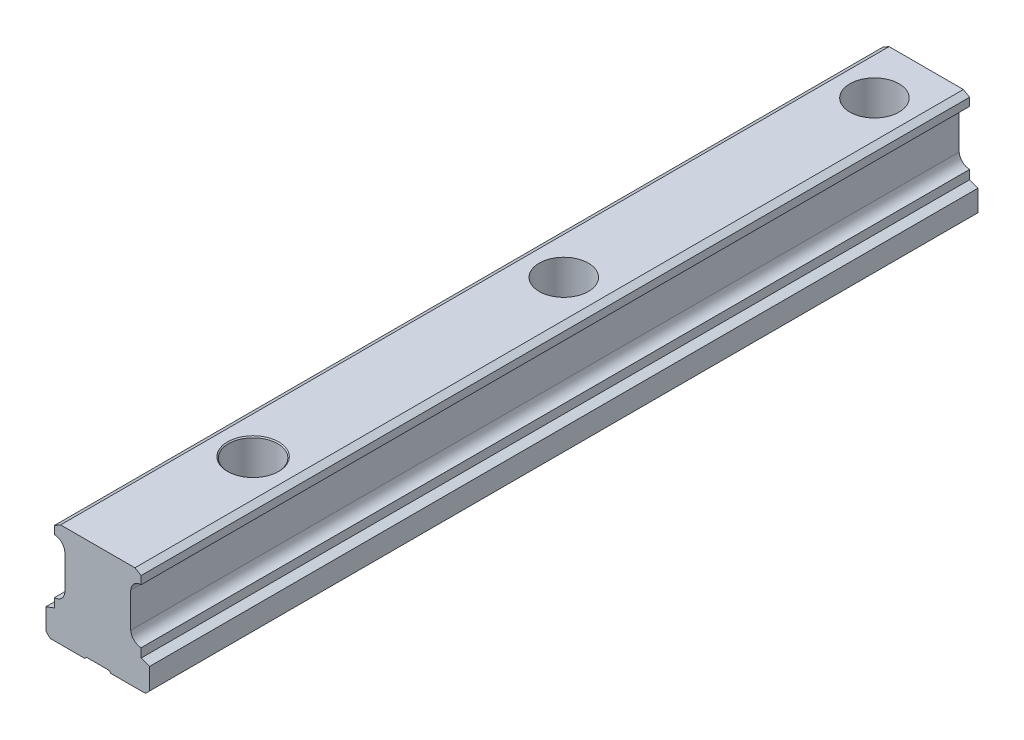
from build123d import *

# Parameters (mm, degrees)
BOSS_EXTRU_1_DEPTH      = 1980
ENL_V_MAT_EXTRU_1_DEPTH = 1981.194091497
ESQUISSE3_W             = 4.3
ESQUISSE3_H             = 0.35
ENL_V_MAT_EXTRU_2_DEPTH = 1980
ESQUISSE4_W             = 1.625
ESQUISSE4_H             = 14.5
ENL_V_MAT_EXTRU_3_DEPTH = 1981.194091497
ENL_V_MAT_EXTRU_4_DEPTH = 1981.194091497
D_POUILLE1_ANGLE        = 20
D_POUILLE2_ANGLE        = 20
D_POUILLE3_ANGLE        = 45
PER_AGE1_D              = 6
PER_AGE1_DEPTH          = 20
PER_AGE1_CBORE_D        = 9.5
PER_AGE1_CBORE_DEPTH    = 8.5
CHANFREIN1_SIZE         = 0.8
CHANFREIN2_SIZE         = 1.2
CHANFREIN2_SIZE2        = 0.692820323
CHANFREIN3_SIZE         = 0.2
CHANFREIN4_SIZE         = 0.692820323
CHANFREIN4_SIZE2        = 1.2
ENL_V_START             = -160
ESQUISSE12_W            = 78.153878041
ESQUISSE12_H            = 74.514600195
ENL_V_MAT_EXTRU_5_DEPTH = 1821.194091497


with BuildPart() as part:
    # Esquisse1 → Boss.-Extru.1 (new body)
    with BuildSketch(Plane(origin=(0, 0, 0), x_dir=(-1, 0, 0), z_dir=(0, 0, -1))):
        with BuildLine():
            Line((-19.2, 7.973691854), (-19.2, 0))
            Line((-19.2, 0), (0.8, 0))
            Line((0.8, 0), (0.8, 20))
            Line((0.8, 20), (-17.575, 20))
            Line((-17.575, 20), (-17.575, 17.767136655))
            ThreePointArc((-17.575, 17.767136655), (-16.197491801, 17.200016465), (-15.5625262, 15.852436102))
            Line((-15.5625262, 15.852436102), (-15.5625262, 9.147563898))
            ThreePointArc((-15.5625262, 9.147563898), (-16.984759825, 7.331984363), (-19.2, 7.973691854))
        make_face()
    extrude(amount=-BOSS_EXTRU_1_DEPTH)

    # Esquisse2 → Enlèv. mat.-Extru.1 (cut, through all)
    with BuildSketch(Plane.XY.offset(1980)):
        with BuildLine():
            Line((17.575, 7.232863345), (17.575, 4.908548369))
            Line((17.575, 4.908548369), (19.2, 4.908548369))
            Line((19.2, 4.908548369), (19.2, 7.973691854))
            ThreePointArc((19.2, 7.973691854), (18.471955551, 7.418025184), (17.575, 7.232863345))
        make_face()
    extrude(amount=-ENL_V_MAT_EXTRU_1_DEPTH, mode=Mode.SUBTRACT)

    # Esquisse3 → Enlèv. mat.-Extru.2 (cut)
    with BuildSketch(Plane.XY.offset(1980)):
        with Locations((9.2, 0.175)):
            Rectangle(ESQUISSE3_W, ESQUISSE3_H)
    extrude(amount=-ENL_V_MAT_EXTRU_2_DEPTH, mode=Mode.SUBTRACT)

    # Esquisse4 → Enlèv. mat.-Extru.3 (cut, through all)
    with BuildSketch(Plane.XY.offset(1980)):
        with Locations((0.0125, 12.75)):
            Rectangle(ESQUISSE4_W, ESQUISSE4_H)
    extrude(amount=-ENL_V_MAT_EXTRU_3_DEPTH, mode=Mode.SUBTRACT)

    # Esquisse5 → Enlèv. mat.-Extru.4 (cut, through all)
    with BuildSketch(Plane.XY.offset(1980)):
        with BuildLine():
            Line((0.825, 17.767136655), (0.825, 7.232863345))
            ThreePointArc((0.825, 7.232863345), (2.202508199, 7.799983535), (2.8374738, 9.147563898))
            Line((2.8374738, 9.147563898), (2.8374738, 15.852436102))
            ThreePointArc((2.8374738, 15.852436102), (2.202508199, 17.200016465), (0.825, 17.767136655))
        make_face()
    extrude(amount=-ENL_V_MAT_EXTRU_4_DEPTH, mode=Mode.SUBTRACT)

    # Dépouille1
    d_pouille1_faces = [part.faces().sort_by_distance(p)[0] for p in [
        (0.0125, 5.5, 990),
    ]]
    draft(d_pouille1_faces, Plane(origin=(0.825, 5.5, 0), x_dir=(0, -1, 0), z_dir=(-1, 0, 0)), D_POUILLE1_ANGLE)

    # Dépouille2
    d_pouille2_faces = [part.faces().sort_by_distance(p)[0] for p in [
        (18.3875, 4.908548369, 990),
    ]]
    draft(d_pouille2_faces, Plane(origin=(19.2, 7.973691854, 1980), x_dir=(0, 0, 1), z_dir=(1, 0, 0)), D_POUILLE2_ANGLE)

    # Dépouille3
    d_pouille3_faces = [part.faces().sort_by_distance(p)[0] for p in [
        (11.35, 0.175, 990),
        (7.05, 0.175, 990),
    ]]
    draft(d_pouille3_faces, Plane(origin=(11.35, 0.35, 0), x_dir=(0, 0, -1), z_dir=(0, -1, 0)), D_POUILLE3_ANGLE)

    # Perçage1
    with Locations(Plane(origin=(0, 20, 0), x_dir=(1, 0, 0), z_dir=(0, 1, 0))):
        with Locations((9.2, -30), (9.2, -90), (9.2, -150), (9.2, -210), (9.2, -270), (9.2, -330), (9.2, -390), (9.2, -450), (9.2, -510), (9.2, -570), (9.2, -630), (9.2, -690), (9.2, -750), (9.2, -810), (9.2, -870), (9.2, -930), (9.2, -990), (9.2, -1050), (9.2, -1110), (9.2, -1170), (9.2, -1230), (9.2, -1290), (9.2, -1350), (9.2, -1410), (9.2, -1470), (9.2, -1530), (9.2, -1590), (9.2, -1650), (9.2, -1710), (9.2, -1770), (9.2, -1830), (9.2, -1890), (9.2, -1950)):
            CounterBoreHole(PER_AGE1_D / 2, PER_AGE1_CBORE_D / 2, PER_AGE1_CBORE_DEPTH, depth=PER_AGE1_DEPTH)

    # Chanfrein1
    chanfrein1_edges = [part.edges().sort_by_distance(p)[0] for p in [
        (-0.8, 0, 990),
        (19.2, 0, 990),
    ]]
    chamfer(chanfrein1_edges, length=CHANFREIN1_SIZE)

    # Chanfrein2
    chanfrein2_edges = [part.edges().sort_by_distance(p)[0] for p in [
        (0.825, 20, 990),
    ]]
    chanfrein2_side = [part.faces().sort_by_distance(p)[0] for p in [
        (9.2, 20, 19.800708478),
    ]]
    chamfer(chanfrein2_edges, length=CHANFREIN2_SIZE, length2=CHANFREIN2_SIZE2, reference=chanfrein2_side[0])

    # Chanfrein3
    chanfrein3_edges = [part.edges().sort_by_distance(p)[0] for p in [
        (12.2, 0, 1950),
        (6.327718677, 0, 1949.133974596),
        (4.45, 20, 1950),
    ]]
    chamfer(chanfrein3_edges, length=CHANFREIN3_SIZE)

    # Chanfrein4
    chanfrein4_edges = [part.edges().sort_by_distance(p)[0] for p in [
        (17.575, 20, 990),
    ]]
    chanfrein4_side = [part.faces().sort_by_distance(p)[0] for p in [
        (17.575, 18.883568328, 990),
    ]]
    chamfer(chanfrein4_edges, length=CHANFREIN4_SIZE, length2=CHANFREIN4_SIZE2, reference=chanfrein4_side[0])

    # Esquisse12 → Enlèv. mat.-Extru.5 (cut, through all)
    with BuildSketch(Plane.XY.offset(1980).offset(ENL_V_START)):
        with Locations((15.863080013, 8.671326529)):
            Rectangle(ESQUISSE12_W, ESQUISSE12_H)
    extrude(amount=-ENL_V_MAT_EXTRU_5_DEPTH, mode=Mode.SUBTRACT)


solid = part.part
